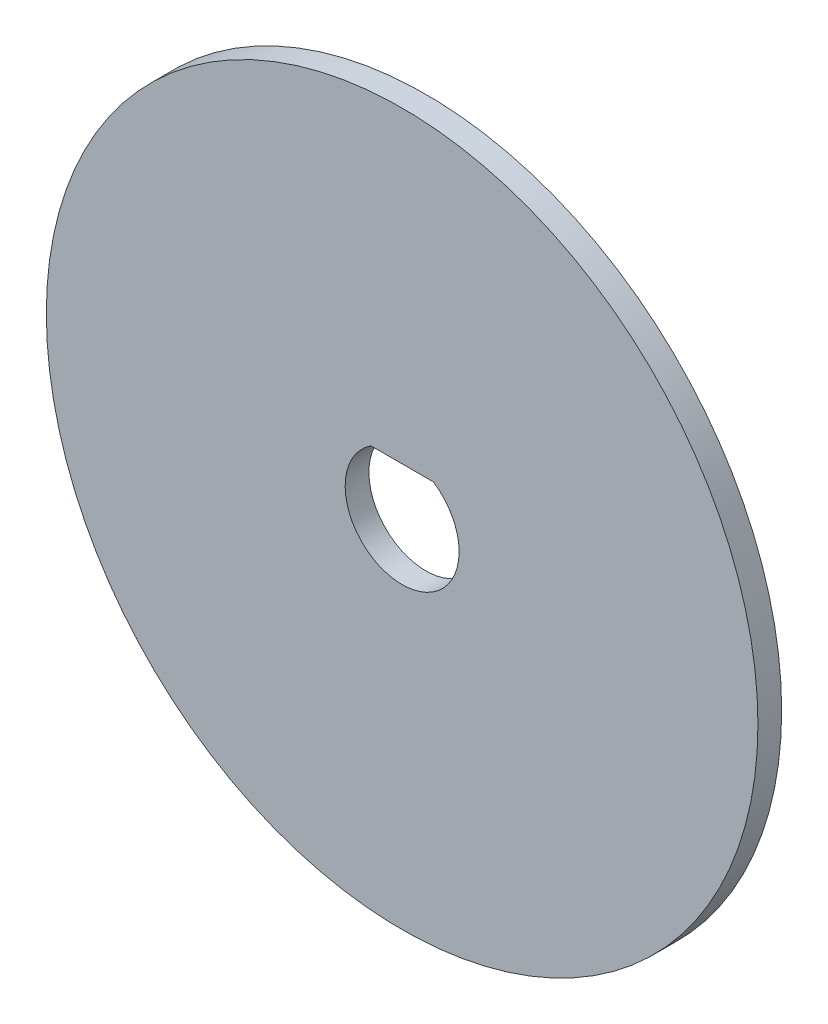
from build123d import *

# Parameters (mm, degrees)
SKETCH1_R           = 19.05
SKETCH1_R_2         = 3.05
BOSS_EXTRUDE1_DEPTH = 1.27
BOSS_EXTRUDE2_DEPTH = 1.27
CIRPATTERN1_COUNT   = 4
BOSS_EXTRUDE3_DEPTH = 2.54


with BuildPart() as part:
    # Sketch1 → Boss-Extrude1 (new body)
    with BuildSketch(Plane.XY):
        Circle(SKETCH1_R)
        Circle(SKETCH1_R_2, mode=Mode.SUBTRACT)
    extrude(amount=BOSS_EXTRUDE1_DEPTH)

    # Sketch2 → Boss-Extrude2 (add)
    with BuildSketch(Plane(origin=(0, 0, 0), x_dir=(-1, 0, 0), z_dir=(0, 0, -1))):
        with BuildLine():
            Line((-1.524, 6.318815031), (-1.524, 7.588815031))
            Line((-1.524, 7.588815031), (1.524, 7.588815031))
            Line((1.524, 7.588815031), (1.524, 6.318815031))
            ThreePointArc((1.524, 6.318815031), (0, 6.499999954), (-1.524, 6.318815031))
        make_face()
    boss_extrude2 = extrude(amount=BOSS_EXTRUDE2_DEPTH)

    # CirPattern1: Boss-Extrude2 ×4 about axis
    cirpattern1_axis = Axis((0, 0, 0), (0, 0, 1))
    for i in range(1, CIRPATTERN1_COUNT):
        add(boss_extrude2.rotate(cirpattern1_axis, i * 360 / CIRPATTERN1_COUNT))

    # Sketch3 → Boss-Extrude3 (add, through all)
    with BuildSketch(Plane.XY.offset(1.27)):
        with BuildLine():
            Line((-1.673320053, 2.55), (1.673320053, 2.55))
            ThreePointArc((1.673320053, 2.55), (0, 3.05), (-1.673320053, 2.55))
        make_face()
    extrude(amount=-BOSS_EXTRUDE3_DEPTH)


solid = part.part
